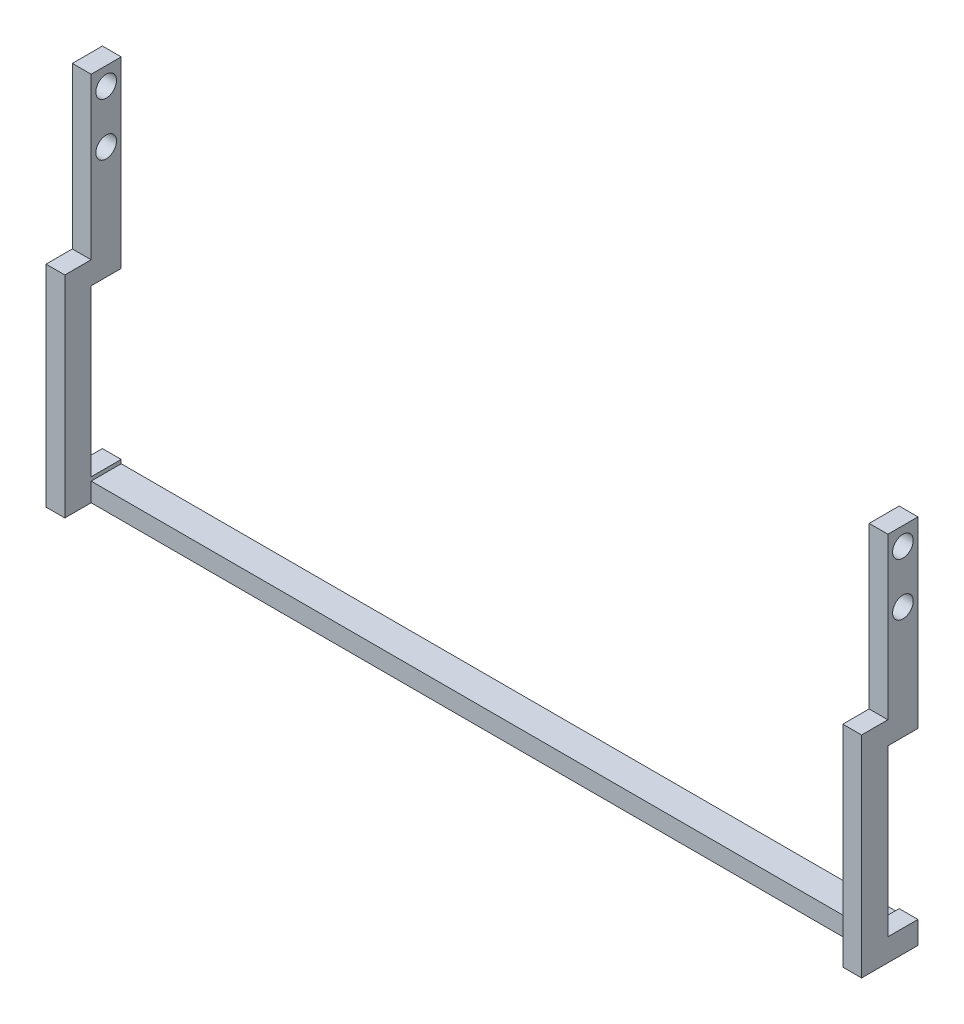
from build123d import *

# Parameters (mm, degrees)
SALIENTE_EXTRUIR1_DEPTH = 80
CROQUIS2_R              = 27.5
CORTAR_EXTRUIR2_DEPTH   = 2387.503718832
SALIENTE_EXTRUIR2_DEPTH = 50
CROQUIS4_W              = 80
CROQUIS4_H              = 440
CORTAR_EXTRUIR3_DEPTH   = 2390.874473691
SALIENTE_EXTRUIR3_DEPTH = 50
ESCALA1_SCALE           = 0.063
CROQUIS9_W              = 136.71
CROQUIS9_H              = 5.04
SALIENTE_EXTRUIR5_DEPTH = 13
CROQUIS10_W             = 130.41
CROQUIS10_H             = 8
CORTAR_EXTRUIR4_DEPTH   = 10
CROQUIS11_W             = 136.71
CROQUIS11_H             = 13.15
CORTAR_EXTRUIR5_DEPTH   = 1192.165803699


with BuildPart() as part:
    # Croquis1 → Saliente-Extruir1 (new body)
    with BuildSketch(Plane.XY):
        Polygon((0, 0), (2170, 0), (2170, 990), (2120, 990), (2120, 50), (50, 50), (50, 990), (0, 990), align=None)
    extrude(amount=SALIENTE_EXTRUIR1_DEPTH)

    # Croquis2 → Cortar-Extruir2 (cut, through all)
    with BuildSketch(Plane.ZY):
        with Locations((40, 940)):
            Circle(CROQUIS2_R)
        with Locations((40, 800)):
            Circle(CROQUIS2_R)
    extrude(amount=-CORTAR_EXTRUIR2_DEPTH, mode=Mode.SUBTRACT)

    # Croquis3 → Saliente-Extruir2 (add)
    with BuildSketch(Plane.ZY):
        Polygon((150, 560), (80, 560), (0, 560), (0, 500), (80, 500), (80, 60), (0, 60), (0, 0), (150, 0), align=None)
    extrude(amount=-SALIENTE_EXTRUIR2_DEPTH)

    # Croquis4 → Cortar-Extruir3 (cut, through all)
    with BuildSketch(Plane.ZY):
        with Locations((40, 280)):
            Rectangle(CROQUIS4_W, CROQUIS4_H)
    extrude(amount=-CORTAR_EXTRUIR3_DEPTH, mode=Mode.SUBTRACT)


with BuildPart() as cortar_extruir3_piece_1:
    # of the separate pieces the step leaves, piece 1, a body of its own (cortar_extruir3_pieces)
    add(part.part.solids().sort_by_distance((0, 0, 0))[0])



with BuildPart() as cortar_extruir3_piece_2:
    # of the separate pieces the step leaves, piece 2, a body of its own (cortar_extruir3_pieces)
    add(part.part.solids().sort_by_distance((2120, 500, 0))[0])


with BuildPart() as cortar_extruir3_piece_1_1:
    add(cortar_extruir3_piece_1.part)

    add(cortar_extruir3_piece_2.part)  # Saliente-Extruir3 merges Cortar-Extruir3 piece 2
    # Croquis5 → Saliente-Extruir3 (add)
    with BuildSketch(Plane(origin=(2170, 0, 0), x_dir=(0, 0, -1), z_dir=(1, 0, 0))):
        Polygon((-150, 50), (-150, 0), (0, 0), (0, 60), (-80, 60), (-80, 500), (0, 500), (0, 560), (-150, 560), align=None)
    extrude(amount=-SALIENTE_EXTRUIR3_DEPTH)


with BuildPart() as cortar_extruir3_piece_1_2:
    # Escala1: scaled about (1085, 237.274110873, 58.232745712)
    add(cortar_extruir3_piece_1_1.part.scale(ESCALA1_SCALE).moved(Location((1016.645, 222.325841888, 54.564082732))))

    # Croquis9 → Saliente-Extruir5 (add)
    with BuildSketch(Plane(origin=(0, 284.695841888, 0), x_dir=(1, 0, 0), z_dir=(0, 1, 0))):
        with Locations((1085, -57.084082732)):
            Rectangle(CROQUIS9_W, CROQUIS9_H)
    extrude(amount=SALIENTE_EXTRUIR5_DEPTH)

    # Croquis10 → Cortar-Extruir4 (cut)
    with BuildSketch(Plane.XY.offset(59.604082732)):
        with Locations((1085, 288.695841888)):
            Rectangle(CROQUIS10_W, CROQUIS10_H)
    extrude(amount=-CORTAR_EXTRUIR4_DEPTH, mode=Mode.SUBTRACT)

    # Croquis11 → Cortar-Extruir5 (cut, through all)
    with BuildSketch(Plane.XY.offset(59.604082732)):
        with Locations((1085, 291.120841888)):
            Rectangle(CROQUIS11_W, CROQUIS11_H)
    extrude(amount=-CORTAR_EXTRUIR5_DEPTH, mode=Mode.SUBTRACT)


solid = cortar_extruir3_piece_1_2.part
